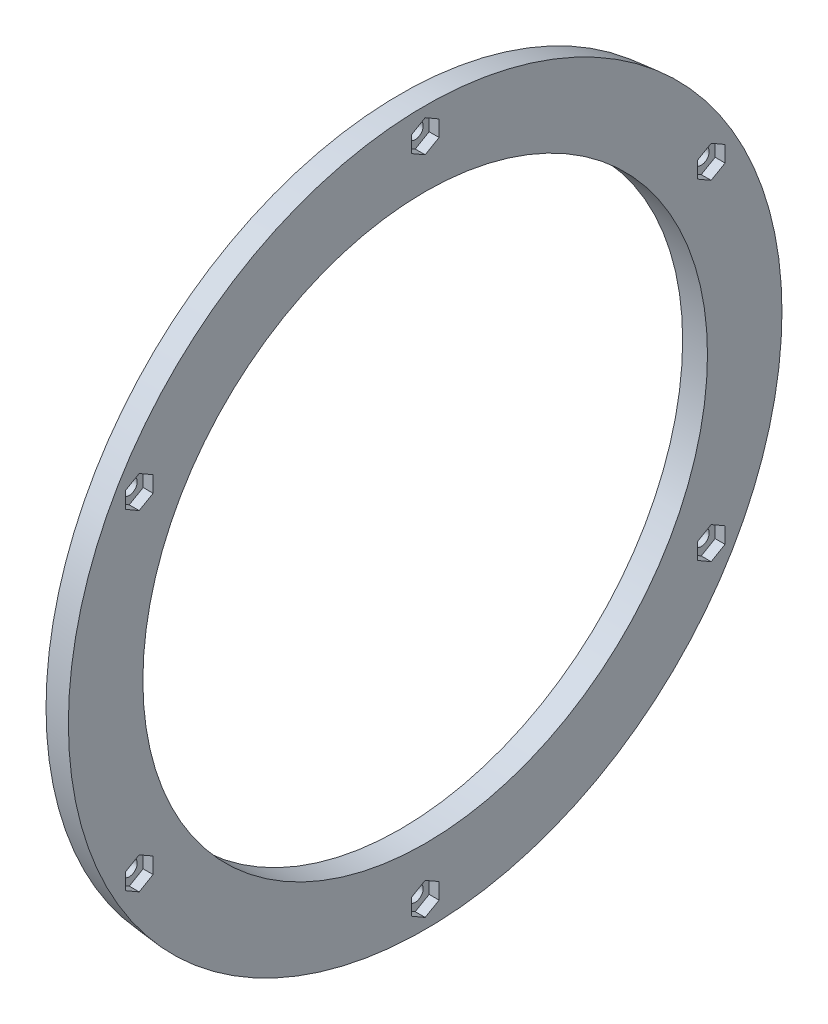
from build123d import *

# Parameters (mm, degrees)
SKETCH1_R           = 71.85
SKETCH1_R_2         = 56.85
BOSS_EXTRUDE1_DEPTH = 5
CUT_EXTRUDE1_DEPTH  = 2
CUT_EXTRUDE2_REACH  = 103.734
SKETCH3_R           = 1.6


with BuildPart() as part:
    # Sketch1 → Boss-Extrude1 (new body)
    with BuildSketch(Plane(origin=(0, 0, 0), x_dir=(0, 0, -1), z_dir=(1, 0, 0))):
        Circle(SKETCH1_R)
        Circle(SKETCH1_R_2, mode=Mode.SUBTRACT)
    extrude(amount=BOSS_EXTRUDE1_DEPTH)

    # Sketch2 → Cut-Extrude1 (cut)
    with BuildSketch(Plane(origin=(5, 0, 0), x_dir=(0, 0, -1), z_dir=(1, 0, 0))):
        Polygon((54.790689352, 31.633419246), (57.590689352, 30.016838493), (60.390689352, 31.633419246), (60.390689352, 34.866580754), (57.590689352, 36.483161507), (54.790689352, 34.866580754), align=None)
        Polygon((0, 63.266838493), (2.8, 64.883419246), (2.8, 68.116580754), (0, 69.733161507), (-2.8, 68.116580754), (-2.8, 64.883419246), align=None)
        Polygon((54.790689352, -31.633419246), (54.790689352, -34.866580754), (57.590689352, -36.483161507), (60.390689352, -34.866580754), (60.390689352, -31.633419246), (57.590689352, -30.016838493), align=None)
        Polygon((0, -63.266838493), (-2.8, -64.883419246), (-2.8, -68.116580754), (0, -69.733161507), (2.8, -68.116580754), (2.8, -64.883419246), align=None)
        Polygon((-54.790689352, -31.633419246), (-57.590689352, -30.016838493), (-60.390689352, -31.633419246), (-60.390689352, -34.866580754), (-57.590689352, -36.483161507), (-54.790689352, -34.866580754), align=None)
        Polygon((-54.790689352, 31.633419246), (-54.790689352, 34.866580754), (-57.590689352, 36.483161507), (-60.390689352, 34.866580754), (-60.390689352, 31.633419246), (-57.590689352, 30.016838493), align=None)
    extrude(amount=-CUT_EXTRUDE1_DEPTH, mode=Mode.SUBTRACT)

    # Sketch3 → Cut-Extrude2 (cut, up to next)
    with BuildSketch(Plane(origin=(5, 0, 0), x_dir=(0, 0, -1), z_dir=(1, 0, 0)), mode=Mode.PRIVATE) as cut_extrude2_sk1:
        with Locations((0, 66.5)):
            Circle(SKETCH3_R)
    cut_extrude2_tool1 = extrude(cut_extrude2_sk1.sketch, amount=-CUT_EXTRUDE2_REACH, mode=Mode.PRIVATE) & part.part
    # Sketch3 → Cut-Extrude2 (cut, up to next)
    with BuildSketch(Plane(origin=(5, 0, 0), x_dir=(0, 0, -1), z_dir=(1, 0, 0)), mode=Mode.PRIVATE) as cut_extrude2_sk2:
        with Locations((57.590689352, 33.25)):
            Circle(SKETCH3_R)
    cut_extrude2_tool2 = extrude(cut_extrude2_sk2.sketch, amount=-CUT_EXTRUDE2_REACH, mode=Mode.PRIVATE) & part.part
    # Sketch3 → Cut-Extrude2 (cut, up to next)
    with BuildSketch(Plane(origin=(5, 0, 0), x_dir=(0, 0, -1), z_dir=(1, 0, 0)), mode=Mode.PRIVATE) as cut_extrude2_sk3:
        with Locations((57.590689352, -33.25)):
            Circle(SKETCH3_R)
    cut_extrude2_tool3 = extrude(cut_extrude2_sk3.sketch, amount=-CUT_EXTRUDE2_REACH, mode=Mode.PRIVATE) & part.part
    # Sketch3 → Cut-Extrude2 (cut, up to next)
    with BuildSketch(Plane(origin=(5, 0, 0), x_dir=(0, 0, -1), z_dir=(1, 0, 0)), mode=Mode.PRIVATE) as cut_extrude2_sk4:
        with Locations((0, -66.5)):
            Circle(SKETCH3_R)
    cut_extrude2_tool4 = extrude(cut_extrude2_sk4.sketch, amount=-CUT_EXTRUDE2_REACH, mode=Mode.PRIVATE) & part.part
    # Sketch3 → Cut-Extrude2 (cut, up to next)
    with BuildSketch(Plane(origin=(5, 0, 0), x_dir=(0, 0, -1), z_dir=(1, 0, 0)), mode=Mode.PRIVATE) as cut_extrude2_sk5:
        with Locations((-57.590689352, -33.25)):
            Circle(SKETCH3_R)
    cut_extrude2_tool5 = extrude(cut_extrude2_sk5.sketch, amount=-CUT_EXTRUDE2_REACH, mode=Mode.PRIVATE) & part.part
    # Sketch3 → Cut-Extrude2 (cut, up to next)
    with BuildSketch(Plane(origin=(5, 0, 0), x_dir=(0, 0, -1), z_dir=(1, 0, 0)), mode=Mode.PRIVATE) as cut_extrude2_sk6:
        with Locations((-57.590689352, 33.25)):
            Circle(SKETCH3_R)
    cut_extrude2_tool6 = extrude(cut_extrude2_sk6.sketch, amount=-CUT_EXTRUDE2_REACH, mode=Mode.PRIVATE) & part.part
    add(cut_extrude2_tool1.solids().sort_by_distance((5, 66.5, 0))[0], mode=Mode.SUBTRACT)
    add(cut_extrude2_tool2.solids().sort_by_distance((5, 33.25, -57.590689))[0], mode=Mode.SUBTRACT)
    add(cut_extrude2_tool3.solids().sort_by_distance((5, -33.25, -57.590689))[0], mode=Mode.SUBTRACT)
    add(cut_extrude2_tool4.solids().sort_by_distance((5, -66.5, 0))[0], mode=Mode.SUBTRACT)
    add(cut_extrude2_tool5.solids().sort_by_distance((5, -33.25, 57.590689))[0], mode=Mode.SUBTRACT)
    add(cut_extrude2_tool6.solids().sort_by_distance((5, 33.25, 57.590689))[0], mode=Mode.SUBTRACT)

    # Sketch4 → Cut-Revolve1 (revolve, cut)
    with BuildSketch(Plane.XY, mode=Mode.PRIVATE) as cut_revolve1_sk:
        Polygon((0, -71.35), (0, -71.85), (5, -71.85), align=None)
    revolve(cut_revolve1_sk.sketch.rotate(Axis((0, 0, 0), (1, 0, 0)), 270), axis=Axis((0, 0, 0), (1, 0, 0)), mode=Mode.SUBTRACT)


solid = part.part
